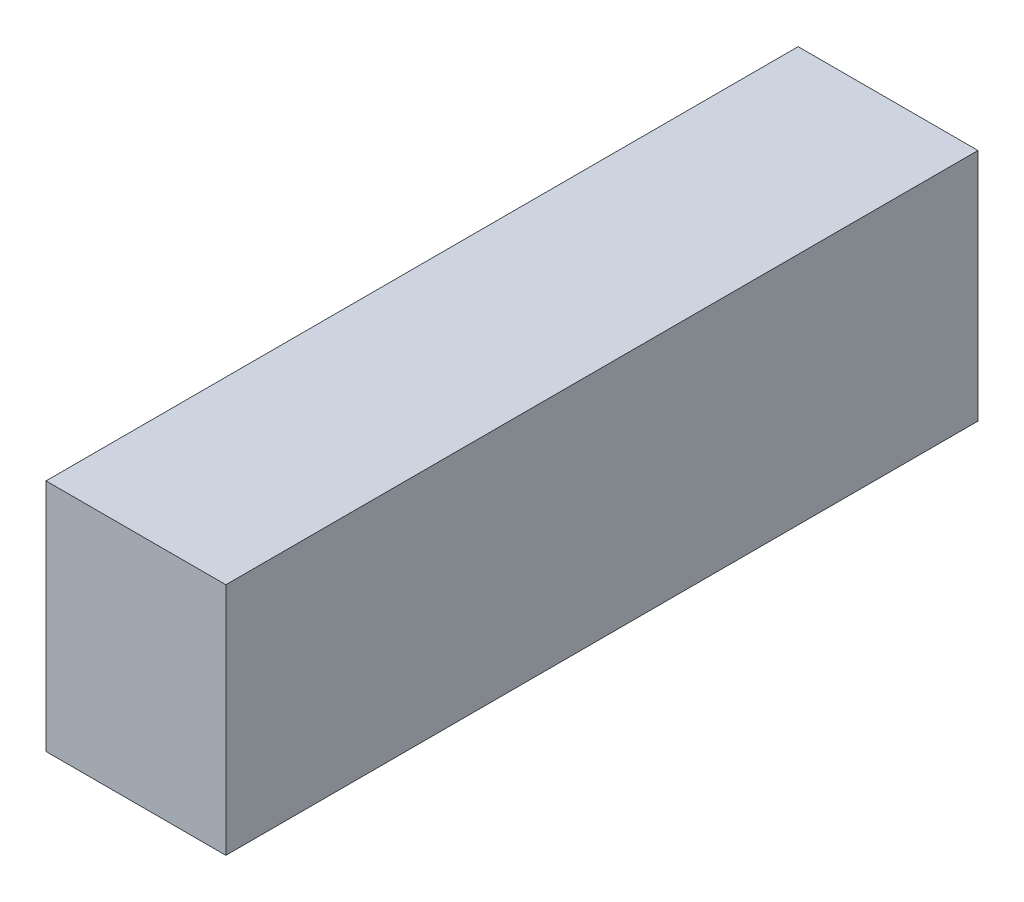
from build123d import *

# Parameters (mm, degrees)
SKETCH1_W           = 138
SKETCH1_H           = 43
BOSS_EXTRUDE1_DEPTH = 33


with BuildPart() as part:
    # Sketch1 → Boss-Extrude1 (new body)
    with BuildSketch(Plane(origin=(0, 0, 0), x_dir=(0, 0, -1), z_dir=(1, 0, 0))):
        with Locations((69, -21.5)):
            Rectangle(SKETCH1_W, SKETCH1_H)
    extrude(amount=BOSS_EXTRUDE1_DEPTH)


solid = part.part
